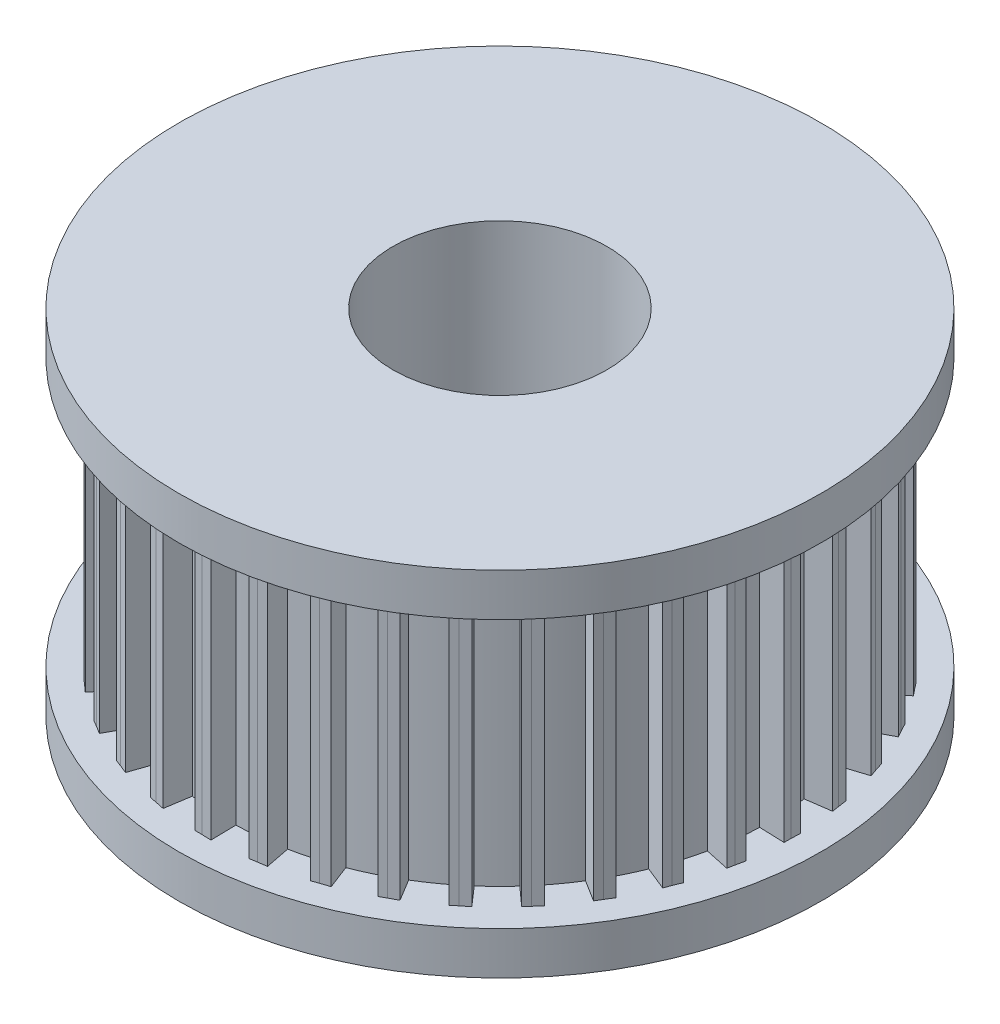
from build123d import *

# Parameters (mm, degrees)
SKETCH1_R           = 19.05
SKETCH1_R_2         = 6.35
BOSS_EXTRUDE1_DEPTH = 2.54
SKETCH2_R           = 6.35
BOSS_EXTRUDE2_DEPTH = 15.875
BOSS_EXTRUDE3_DEPTH = 15.875
SKETCH4_R           = 19.05
SKETCH4_R_2         = 6.35
BOSS_EXTRUDE4_DEPTH = 2.54


with BuildPart() as part:
    # Sketch1 → Boss-Extrude1 (new body)
    with BuildSketch(Plane(origin=(0, 0, 0), x_dir=(1, 0, 0), z_dir=(0, 1, 0))):
        Circle(SKETCH1_R)
        Circle(SKETCH1_R_2, mode=Mode.SUBTRACT)
    extrude(amount=BOSS_EXTRUDE1_DEPTH)

    # Sketch2 → Boss-Extrude2 (add)
    with BuildSketch(Plane(origin=(0, 2.54, 0), x_dir=(1, 0, 0), z_dir=(0, 1, 0))):
        with BuildLine():
            ThreePointArc((-4.936930696, 15.20193545), (-5.351844725, 15.060872622), (-5.76273548, 14.908487713))
            ThreePointArc((-5.76273548, 14.908487713), (-6.64412088, 14.537117453), (-7.501716013, 14.113694873))
            ThreePointArc((-7.501716013, 14.113694873), (-7.885831263, 13.902726042), (-8.264018303, 13.681305771))
            ThreePointArc((-8.264018303, 13.681305771), (-9.067525709, 13.162526491), (-9.838565485, 12.596616819))
            ThreePointArc((-9.838565485, 12.596616819), (-10.180210809, 12.322152166), (-10.514203111, 12.038424276))
            ThreePointArc((-10.514203111, 12.038424276), (-11.215418357, 11.387998822), (-11.876475124, 10.696796938))
            ThreePointArc((-11.876475124, 10.696796938), (-12.1652698, 10.367175931), (-12.444919178, 10.029761352))
            ThreePointArc((-12.444919178, 10.029761352), (-13.022536194, 9.267452572), (-13.553524076, 8.471960295))
            ThreePointArc((-13.553524076, 8.471960295), (-13.780693225, 8.097198303), (-13.997502673, 7.716349203))
            ThreePointArc((-13.997502673, 7.716349203), (-14.433970859, 6.865319465), (-14.818756057, 5.989707425))
            ThreePointArc((-14.818756057, 5.989707425), (-14.977397259, 5.581191401), (-15.124779133, 5.168479689))
            ThreePointArc((-15.124779133, 5.168479689), (-15.406836623, 4.2545871), (-15.633727634, 3.325460325))
            ThreePointArc((-15.633727634, 3.325460325), (-15.719020657, 2.895602822), (-15.792496832, 2.463568536))
            ThreePointArc((-15.792496832, 2.463568536), (-15.911573452, 1.514581258), (-15.973676308, 0.560170797))
            ThreePointArc((-15.973676308, 0.560170797), (-15.983029566, 0.122032817), (-15.980367506, -0.316196902))
            ThreePointArc((-15.980367506, -0.316196902), (-15.932845174, -1.271444368), (-15.82827291, -2.222139237))
            ThreePointArc((-15.82827291, -2.222139237), (-15.761402209, -2.655245093), (-15.6826828, -3.086354856))
            ThreePointArc((-15.6826828, -3.086354856), (-15.470005457, -4.0188378), (-15.20193545, -4.936930696))
            ThreePointArc((-15.20193545, -4.936930696), (-15.060872622, -5.351844725), (-14.908487713, -5.76273548))
            ThreePointArc((-14.908487713, -5.76273548), (-14.537117453, -6.64412088), (-14.113694873, -7.501716013))
            ThreePointArc((-14.113694873, -7.501716013), (-13.902726042, -7.885831263), (-13.681305771, -8.264018303))
            ThreePointArc((-13.681305771, -8.264018303), (-13.162526491, -9.067525709), (-12.596616819, -9.838565485))
            ThreePointArc((-12.596616819, -9.838565485), (-12.322152166, -10.180210809), (-12.038424276, -10.514203111))
            ThreePointArc((-12.038424276, -10.514203111), (-11.387998822, -11.215418357), (-10.696796938, -11.876475124))
            ThreePointArc((-10.696796938, -11.876475124), (-10.367175931, -12.1652698), (-10.029761352, -12.444919178))
            ThreePointArc((-10.029761352, -12.444919178), (-9.267452572, -13.022536194), (-8.471960295, -13.553524076))
            ThreePointArc((-8.471960295, -13.553524076), (-8.097198303, -13.780693225), (-7.716349203, -13.997502673))
            ThreePointArc((-7.716349203, -13.997502673), (-6.865319465, -14.433970859), (-5.989707425, -14.818756057))
            ThreePointArc((-5.989707425, -14.818756057), (-5.581191401, -14.977397259), (-5.168479689, -15.124779133))
            ThreePointArc((-5.168479689, -15.124779133), (-4.2545871, -15.406836623), (-3.325460325, -15.633727634))
            ThreePointArc((-3.325460325, -15.633727634), (-2.895602822, -15.719020657), (-2.463568536, -15.792496832))
            ThreePointArc((-2.463568536, -15.792496832), (-1.514581258, -15.911573452), (-0.560170797, -15.973676308))
            ThreePointArc((-0.560170797, -15.973676308), (-0.122032817, -15.983029566), (0.316196902, -15.980367506))
            ThreePointArc((0.316196902, -15.980367506), (1.271444368, -15.932845174), (2.222139237, -15.82827291))
            ThreePointArc((2.222139237, -15.82827291), (2.655245093, -15.761402209), (3.086354856, -15.6826828))
            ThreePointArc((3.086354856, -15.6826828), (4.0188378, -15.470005457), (4.936930696, -15.20193545))
            ThreePointArc((4.936930696, -15.20193545), (5.351844725, -15.060872622), (5.76273548, -14.908487713))
            ThreePointArc((5.76273548, -14.908487713), (6.64412088, -14.537117453), (7.501716013, -14.113694873))
            ThreePointArc((7.501716013, -14.113694873), (7.885831263, -13.902726042), (8.264018303, -13.681305771))
            ThreePointArc((8.264018303, -13.681305771), (9.067525709, -13.162526491), (9.838565485, -12.596616819))
            ThreePointArc((9.838565485, -12.596616819), (10.180210809, -12.322152166), (10.514203111, -12.038424276))
            ThreePointArc((10.514203111, -12.038424276), (11.215418357, -11.387998822), (11.876475124, -10.696796938))
            ThreePointArc((11.876475124, -10.696796938), (12.1652698, -10.367175931), (12.444919178, -10.029761352))
            ThreePointArc((12.444919178, -10.029761352), (13.022536194, -9.267452572), (13.553524076, -8.471960295))
            ThreePointArc((13.553524076, -8.471960295), (13.780693225, -8.097198303), (13.997502673, -7.716349203))
            ThreePointArc((13.997502673, -7.716349203), (14.433970859, -6.865319465), (14.818756057, -5.989707425))
            ThreePointArc((14.818756057, -5.989707425), (14.977397259, -5.581191401), (15.124779133, -5.168479689))
            ThreePointArc((15.124779133, -5.168479689), (15.406836623, -4.2545871), (15.633727634, -3.325460325))
            ThreePointArc((15.633727634, -3.325460325), (15.719020657, -2.895602822), (15.792496832, -2.463568536))
            ThreePointArc((15.792496832, -2.463568536), (15.911573452, -1.514581258), (15.973676308, -0.560170797))
            ThreePointArc((15.973676308, -0.560170797), (15.98104046, -0.280128425), (15.983495428, 0))
            ThreePointArc((15.983495428, 0), (15.982713429, 0.158106186), (15.980367506, 0.316196902))
            ThreePointArc((15.980367506, 0.316196902), (15.932845174, 1.271444368), (15.82827291, 2.222139237))
            ThreePointArc((15.82827291, 2.222139237), (15.761402209, 2.655245093), (15.6826828, 3.086354856))
            ThreePointArc((15.6826828, 3.086354856), (15.470005457, 4.0188378), (15.20193545, 4.936930696))
            ThreePointArc((15.20193545, 4.936930696), (15.060872622, 5.351844725), (14.908487713, 5.76273548))
            ThreePointArc((14.908487713, 5.76273548), (14.537117453, 6.64412088), (14.113694873, 7.501716013))
            ThreePointArc((14.113694873, 7.501716013), (13.902726042, 7.885831263), (13.681305771, 8.264018303))
            ThreePointArc((13.681305771, 8.264018303), (13.162526491, 9.067525709), (12.596616819, 9.838565485))
            ThreePointArc((12.596616819, 9.838565485), (12.322152166, 10.180210809), (12.038424276, 10.514203111))
            ThreePointArc((12.038424276, 10.514203111), (11.387998822, 11.215418357), (10.696796938, 11.876475124))
            ThreePointArc((10.696796938, 11.876475124), (10.367175931, 12.1652698), (10.029761352, 12.444919178))
            ThreePointArc((10.029761352, 12.444919178), (9.267452572, 13.022536194), (8.471960295, 13.553524076))
            ThreePointArc((8.471960295, 13.553524076), (8.097198303, 13.780693225), (7.716349203, 13.997502673))
            ThreePointArc((7.716349203, 13.997502673), (6.865319465, 14.433970859), (5.989707425, 14.818756057))
            ThreePointArc((5.989707425, 14.818756057), (5.581191401, 14.977397259), (5.168479689, 15.124779133))
            ThreePointArc((5.168479689, 15.124779133), (4.2545871, 15.406836623), (3.325460325, 15.633727634))
            ThreePointArc((3.325460325, 15.633727634), (2.895602822, 15.719020657), (2.463568536, 15.792496832))
            ThreePointArc((2.463568536, 15.792496832), (1.514581258, 15.911573452), (0.560170797, 15.973676308))
            ThreePointArc((0.560170797, 15.973676308), (0.122032817, 15.983029566), (-0.316196902, 15.980367506))
            ThreePointArc((-0.316196902, 15.980367506), (-1.271444368, 15.932845174), (-2.222139237, 15.82827291))
            ThreePointArc((-2.222139237, 15.82827291), (-2.655245093, 15.761402209), (-3.086354856, 15.6826828))
            ThreePointArc((-3.086354856, 15.6826828), (-4.0188378, 15.470005457), (-4.936930696, 15.20193545))
        make_face()
        Circle(SKETCH2_R, mode=Mode.SUBTRACT)
    extrude(amount=BOSS_EXTRUDE2_DEPTH)

    # Sketch2<6> → Boss-Extrude3 (add)
    with BuildSketch(Plane(origin=(0, 2.54, 0), x_dir=(1, 0, 0), z_dir=(0, 1, 0))):
        with BuildLine():
            Line((-5.795489656, 16.486731635), (-6.308403836, 16.320159308))
            Line((-6.308403836, 16.320159308), (-5.76273548, 14.908487713))
            ThreePointArc((-5.76273548, 14.908487713), (-5.351844725, 15.060872622), (-4.936930696, 15.20193545))
            Line((-4.936930696, 15.20193545), (-5.399395028, 16.625968591))
            Line((-5.399395028, 16.625968591), (-5.795489656, 16.486731635))
        make_face()
        with BuildLine():
            ThreePointArc((-8.264018303, 13.681305771), (-7.885831263, 13.902726042), (-7.501716013, 14.113694873))
            Line((-7.501716013, 14.113694873), (-8.204435233, 15.435787662))
            Line((-8.204435233, 15.435787662), (-8.57033405, 15.229884918))
            Line((-8.57033405, 15.229884918), (-9.04653093, 14.976776587))
            Line((-9.04653093, 14.976776587), (-8.264018303, 13.681305771))
        make_face()
        with BuildLine():
            Line((-3.378599084, 17.167662247), (-3.086354856, 15.6826828))
            ThreePointArc((-3.086354856, 15.6826828), (-2.655245093, 15.761402209), (-2.222139237, 15.82827291))
            Line((-2.222139237, 15.82827291), (-2.430296937, 17.310977877))
            Line((-2.430296937, 17.310977877), (-2.844552242, 17.242637353))
            Line((-2.844552242, 17.242637353), (-3.378599084, 17.167662247))
        make_face()
        with BuildLine():
            ThreePointArc((-10.514203111, 12.038424276), (-10.180210809, 12.322152166), (-9.838565485, 12.596616819))
            Line((-9.838565485, 12.596616819), (-10.760187825, 13.776598137))
            Line((-10.760187825, 13.776598137), (-11.084773181, 13.510285855))
            Line((-11.084773181, 13.510285855), (-11.50978376, 13.178332088))
            Line((-11.50978376, 13.178332088), (-10.514203111, 12.038424276))
        make_face()
        with BuildLine():
            Line((-0.346137308, 17.493534456), (-0.316196902, 15.980367506))
            ThreePointArc((-0.316196902, 15.980367506), (0.122032817, 15.983029566), (0.560170797, 15.973676308))
            Line((0.560170797, 15.973676308), (0.612644496, 17.470001859))
            Line((0.612644496, 17.470001859), (0.192815453, 17.474634261))
            Line((0.192815453, 17.474634261), (-0.346137308, 17.493534456))
        make_face()
        with BuildLine():
            ThreePointArc((-12.444919178, 10.029761352), (-12.1652698, 10.367175931), (-11.876475124, 10.696796938))
            Line((-11.876475124, 10.696796938), (-12.988997555, 11.698813648))
            Line((-12.988997555, 11.698813648), (-13.262407087, 11.380183593))
            Line((-13.262407087, 11.380183593), (-13.623317634, 10.979470636))
            Line((-13.623317634, 10.979470636), (-12.444919178, 10.029761352))
        make_face()
        with BuildLine():
            Line((2.696841674, 17.287874473), (2.463568536, 15.792496832))
            ThreePointArc((2.463568536, 15.792496832), (2.895602822, 15.719020657), (3.325460325, 15.633727634))
            Line((3.325460325, 15.633727634), (3.636971036, 17.098208676))
            Line((3.636971036, 17.098208676), (3.224324548, 17.175673249))
            Line((3.224324548, 17.175673249), (2.696841674, 17.287874473))
        make_face()
        with BuildLine():
            ThreePointArc((-13.997502673, 7.716349203), (-13.780693225, 8.097198303), (-13.553524076, 8.471960295))
            Line((-13.553524076, 8.471960295), (-14.823143167, 9.265566627))
            Line((-14.823143167, 9.265566627), (-15.037069466, 8.904300211))
            Line((-15.037069466, 8.904300211), (-15.322913895, 8.447003526))
            Line((-15.322913895, 8.447003526), (-13.997502673, 7.716349203))
        make_face()
        with BuildLine():
            Line((5.657878487, 16.556931172), (5.168479689, 15.124779133))
            ThreePointArc((5.168479689, 15.124779133), (5.581191401, 14.977397259), (5.989707425, 14.818756057))
            Line((5.989707425, 14.818756057), (6.550790052, 16.206895074))
            Line((6.550790052, 16.206895074), (6.157864173, 16.354838097))
            Line((6.157864173, 16.354838097), (5.657878487, 16.556931172))
        make_face()
        with BuildLine():
            ThreePointArc((-15.124779133, 5.168479689), (-14.977397259, 5.581191401), (-14.818756057, 5.989707425))
            Line((-14.818756057, 5.989707425), (-16.206895074, 6.550790052))
            Line((-16.206895074, 6.550790052), (-16.354838097, 6.157864173))
            Line((-16.354838097, 6.157864173), (-16.556931172, 5.657878487))
            Line((-16.556931172, 5.657878487), (-15.124779133, 5.168479689))
        make_face()
        with BuildLine():
            Line((8.447003526, 15.322913895), (7.716349203, 13.997502673))
            ThreePointArc((7.716349203, 13.997502673), (8.097198303, 13.780693225), (8.471960295, 13.553524076))
            Line((8.471960295, 13.553524076), (9.265566627, 14.823143167))
            Line((9.265566627, 14.823143167), (8.904300211, 15.037069466))
            Line((8.904300211, 15.037069466), (8.447003526, 15.322913895))
        make_face()
        with BuildLine():
            ThreePointArc((-15.792496832, 2.463568536), (-15.719020657, 2.895602822), (-15.633727634, 3.325460325))
            Line((-15.633727634, 3.325460325), (-17.098208676, 3.636971036))
            Line((-17.098208676, 3.636971036), (-17.175673249, 3.224324548))
            Line((-17.175673249, 3.224324548), (-17.287874473, 2.696841674))
            Line((-17.287874473, 2.696841674), (-15.792496832, 2.463568536))
        make_face()
        with BuildLine():
            Line((10.979470636, 13.623317634), (10.029761352, 12.444919178))
            ThreePointArc((10.029761352, 12.444919178), (10.367175931, 12.1652698), (10.696796938, 11.876475124))
            Line((10.696796938, 11.876475124), (11.698813648, 12.988997555))
            Line((11.698813648, 12.988997555), (11.380183593, 13.262407087))
            Line((11.380183593, 13.262407087), (10.979470636, 13.623317634))
        make_face()
        with BuildLine():
            ThreePointArc((-15.980367506, -0.316196902), (-15.983029566, 0.122032817), (-15.973676308, 0.560170797))
            Line((-15.973676308, 0.560170797), (-17.470001859, 0.612644496))
            Line((-17.470001859, 0.612644496), (-17.474634261, 0.192815453))
            Line((-17.474634261, 0.192815453), (-17.493534456, -0.346137308))
            Line((-17.493534456, -0.346137308), (-15.980367506, -0.316196902))
        make_face()
        with BuildLine():
            Line((13.178332088, 11.50978376), (12.038424276, 10.514203111))
            ThreePointArc((12.038424276, 10.514203111), (12.322152166, 10.180210809), (12.596616819, 9.838565485))
            Line((12.596616819, 9.838565485), (13.776598137, 10.760187825))
            Line((13.776598137, 10.760187825), (13.510285855, 11.084773181))
            Line((13.510285855, 11.084773181), (13.178332088, 11.50978376))
        make_face()
        with BuildLine():
            ThreePointArc((-15.6826828, -3.086354856), (-15.761402209, -2.655245093), (-15.82827291, -2.222139237))
            Line((-15.82827291, -2.222139237), (-17.310977877, -2.430296937))
            Line((-17.310977877, -2.430296937), (-17.242637353, -2.844552242))
            Line((-17.242637353, -2.844552242), (-17.167662247, -3.378599084))
            Line((-17.167662247, -3.378599084), (-15.6826828, -3.086354856))
        make_face()
        with BuildLine():
            Line((14.976776587, 9.04653093), (13.681305771, 8.264018303))
            ThreePointArc((13.681305771, 8.264018303), (13.902726042, 7.885831263), (14.113694873, 7.501716013))
            Line((14.113694873, 7.501716013), (15.435787662, 8.204435233))
            Line((15.435787662, 8.204435233), (15.229884918, 8.57033405))
            Line((15.229884918, 8.57033405), (14.976776587, 9.04653093))
        make_face()
        with BuildLine():
            ThreePointArc((-14.908487713, -5.76273548), (-15.060872622, -5.351844725), (-15.20193545, -4.936930696))
            Line((-15.20193545, -4.936930696), (-16.625968591, -5.399395028))
            Line((-16.625968591, -5.399395028), (-16.486731635, -5.795489656))
            Line((-16.486731635, -5.795489656), (-16.320159308, -6.308403837))
            Line((-16.320159308, -6.308403837), (-14.908487713, -5.76273548))
        make_face()
        with BuildLine():
            Line((16.320159308, 6.308403836), (14.908487713, 5.76273548))
            ThreePointArc((14.908487713, 5.76273548), (15.060872622, 5.351844725), (15.20193545, 4.936930696))
            Line((15.20193545, 4.936930696), (16.625968591, 5.399395028))
            Line((16.625968591, 5.399395028), (16.486731635, 5.795489656))
            Line((16.486731635, 5.795489656), (16.320159308, 6.308403836))
        make_face()
        with BuildLine():
            ThreePointArc((-13.681305771, -8.264018303), (-13.902726042, -7.885831263), (-14.113694873, -7.501716013))
            Line((-14.113694873, -7.501716013), (-15.435787662, -8.204435233))
            Line((-15.435787662, -8.204435233), (-15.229884918, -8.57033405))
            Line((-15.229884918, -8.57033405), (-14.976776587, -9.04653093))
            Line((-14.976776587, -9.04653093), (-13.681305771, -8.264018303))
        make_face()
        with BuildLine():
            Line((17.167662247, 3.378599084), (15.6826828, 3.086354856))
            ThreePointArc((15.6826828, 3.086354856), (15.761402209, 2.655245093), (15.82827291, 2.222139237))
            Line((15.82827291, 2.222139237), (17.310977877, 2.430296937))
            Line((17.310977877, 2.430296937), (17.242637353, 2.844552242))
            Line((17.242637353, 2.844552242), (17.167662247, 3.378599084))
        make_face()
        with BuildLine():
            ThreePointArc((-12.038424276, -10.514203111), (-12.322152166, -10.180210809), (-12.596616819, -9.838565485))
            Line((-12.596616819, -9.838565485), (-13.776598137, -10.760187825))
            Line((-13.776598137, -10.760187825), (-13.510285855, -11.084773181))
            Line((-13.510285855, -11.084773181), (-13.178332088, -11.50978376))
            Line((-13.178332088, -11.50978376), (-12.038424276, -10.514203111))
        make_face()
        with BuildLine():
            Line((17.493534456, 0.346137308), (15.980367506, 0.316196902))
            ThreePointArc((15.980367506, 0.316196902), (15.983029566, -0.122032817), (15.973676308, -0.560170797))
            Line((15.973676308, -0.560170797), (17.470001859, -0.612644496))
            Line((17.470001859, -0.612644496), (17.474634261, -0.192815453))
            Line((17.474634261, -0.192815453), (17.493534456, 0.346137308))
        make_face()
        with BuildLine():
            ThreePointArc((-10.029761352, -12.444919178), (-10.367175931, -12.1652698), (-10.696796938, -11.876475124))
            Line((-10.696796938, -11.876475124), (-11.698813648, -12.988997555))
            Line((-11.698813648, -12.988997555), (-11.380183593, -13.262407087))
            Line((-11.380183593, -13.262407087), (-10.979470636, -13.623317634))
            Line((-10.979470636, -13.623317634), (-10.029761352, -12.444919178))
        make_face()
        with BuildLine():
            Line((17.287874473, -2.696841674), (15.792496832, -2.463568536))
            ThreePointArc((15.792496832, -2.463568536), (15.719020657, -2.895602822), (15.633727634, -3.325460325))
            Line((15.633727634, -3.325460325), (17.098208676, -3.636971036))
            Line((17.098208676, -3.636971036), (17.175673249, -3.224324548))
            Line((17.175673249, -3.224324548), (17.287874473, -2.696841674))
        make_face()
        with BuildLine():
            ThreePointArc((-7.716349203, -13.997502673), (-8.097198303, -13.780693225), (-8.471960295, -13.553524076))
            Line((-8.471960295, -13.553524076), (-9.265566627, -14.823143167))
            Line((-9.265566627, -14.823143167), (-8.904300211, -15.037069466))
            Line((-8.904300211, -15.037069466), (-8.447003526, -15.322913895))
            Line((-8.447003526, -15.322913895), (-7.716349203, -13.997502673))
        make_face()
        with BuildLine():
            Line((16.556931172, -5.657878487), (15.124779133, -5.168479689))
            ThreePointArc((15.124779133, -5.168479689), (14.977397259, -5.581191401), (14.818756057, -5.989707425))
            Line((14.818756057, -5.989707425), (16.206895074, -6.550790052))
            Line((16.206895074, -6.550790052), (16.354838097, -6.157864173))
            Line((16.354838097, -6.157864173), (16.556931172, -5.657878487))
        make_face()
        with BuildLine():
            ThreePointArc((-5.168479689, -15.124779133), (-5.581191401, -14.977397259), (-5.989707425, -14.818756057))
            Line((-5.989707425, -14.818756057), (-6.550790052, -16.206895074))
            Line((-6.550790052, -16.206895074), (-6.157864173, -16.354838097))
            Line((-6.157864173, -16.354838097), (-5.657878487, -16.556931172))
            Line((-5.657878487, -16.556931172), (-5.168479689, -15.124779133))
        make_face()
        with BuildLine():
            Line((15.322913895, -8.447003526), (13.997502673, -7.716349203))
            ThreePointArc((13.997502673, -7.716349203), (13.780693225, -8.097198303), (13.553524076, -8.471960295))
            Line((13.553524076, -8.471960295), (14.823143167, -9.265566627))
            Line((14.823143167, -9.265566627), (15.037069466, -8.904300211))
            Line((15.037069466, -8.904300211), (15.322913895, -8.447003526))
        make_face()
        with BuildLine():
            ThreePointArc((-2.463568536, -15.792496832), (-2.895602822, -15.719020657), (-3.325460325, -15.633727634))
            Line((-3.325460325, -15.633727634), (-3.636971036, -17.098208676))
            Line((-3.636971036, -17.098208676), (-3.224324548, -17.175673249))
            Line((-3.224324548, -17.175673249), (-2.696841674, -17.287874473))
            Line((-2.696841674, -17.287874473), (-2.463568536, -15.792496832))
        make_face()
        with BuildLine():
            Line((13.623317634, -10.979470636), (12.444919178, -10.029761352))
            ThreePointArc((12.444919178, -10.029761352), (12.1652698, -10.367175931), (11.876475124, -10.696796938))
            Line((11.876475124, -10.696796938), (12.988997555, -11.698813648))
            Line((12.988997555, -11.698813648), (13.262407087, -11.380183593))
            Line((13.262407087, -11.380183593), (13.623317634, -10.979470636))
        make_face()
        with BuildLine():
            ThreePointArc((0.316196902, -15.980367506), (-0.122032817, -15.983029566), (-0.560170797, -15.973676308))
            Line((-0.560170797, -15.973676308), (-0.612644496, -17.470001859))
            Line((-0.612644496, -17.470001859), (-0.192815453, -17.474634261))
            Line((-0.192815453, -17.474634261), (0.346137308, -17.493534456))
            Line((0.346137308, -17.493534456), (0.316196902, -15.980367506))
        make_face()
        with BuildLine():
            Line((11.50978376, -13.178332088), (10.514203111, -12.038424276))
            ThreePointArc((10.514203111, -12.038424276), (10.180210809, -12.322152166), (9.838565485, -12.596616819))
            Line((9.838565485, -12.596616819), (10.760187825, -13.776598137))
            Line((10.760187825, -13.776598137), (11.084773181, -13.510285855))
            Line((11.084773181, -13.510285855), (11.50978376, -13.178332088))
        make_face()
        with BuildLine():
            ThreePointArc((3.086354856, -15.6826828), (2.655245093, -15.761402209), (2.222139237, -15.82827291))
            Line((2.222139237, -15.82827291), (2.430296937, -17.310977877))
            Line((2.430296937, -17.310977877), (2.844552242, -17.242637353))
            Line((2.844552242, -17.242637353), (3.378599084, -17.167662247))
            Line((3.378599084, -17.167662247), (3.086354856, -15.6826828))
        make_face()
        with BuildLine():
            Line((9.04653093, -14.976776587), (8.264018303, -13.681305771))
            ThreePointArc((8.264018303, -13.681305771), (7.885831263, -13.902726042), (7.501716013, -14.113694873))
            Line((7.501716013, -14.113694873), (8.204435233, -15.435787662))
            Line((8.204435233, -15.435787662), (8.57033405, -15.229884918))
            Line((8.57033405, -15.229884918), (9.04653093, -14.976776587))
        make_face()
        with BuildLine():
            ThreePointArc((5.76273548, -14.908487713), (5.351844725, -15.060872622), (4.936930696, -15.20193545))
            Line((4.936930696, -15.20193545), (5.399395028, -16.625968591))
            Line((5.399395028, -16.625968591), (5.795489656, -16.486731635))
            Line((5.795489656, -16.486731635), (6.308403837, -16.320159308))
            Line((6.308403837, -16.320159308), (5.76273548, -14.908487713))
        make_face()
    extrude(amount=BOSS_EXTRUDE3_DEPTH)

    # Sketch4 → Boss-Extrude4 (add)
    with BuildSketch(Plane(origin=(0, 18.415, 0), x_dir=(1, 0, 0), z_dir=(0, 1, 0))):
        Circle(SKETCH4_R)
        Circle(SKETCH4_R_2, mode=Mode.SUBTRACT)
    extrude(amount=BOSS_EXTRUDE4_DEPTH)


solid = part.part
